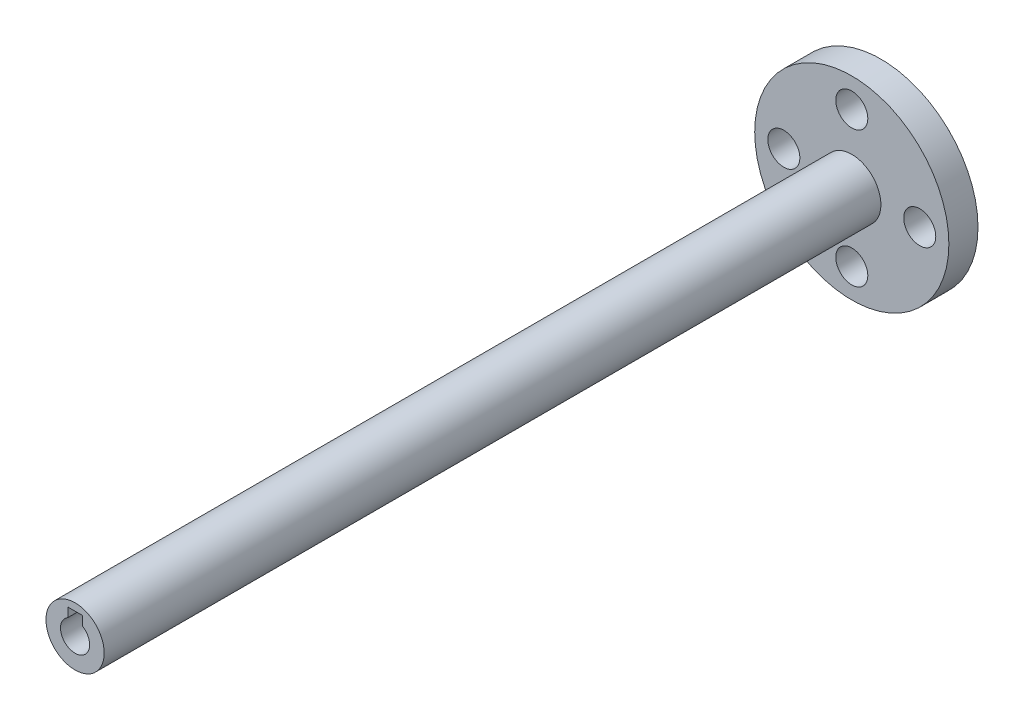
from build123d import *

# Parameters (mm, degrees)
SKETCH_1_R          = 10
SKETCH_1_R_2        = 1.65
EXTRUDE_1_DEPTH     = 3
SKETCH_2_R          = 3
EXTRUDE_2_DEPTH     = 80
CUT_EXTRUDE_1_DEPTH = 20


with BuildPart() as part:
    # 草图1 → 凸台-拉伸1 (new body)
    with BuildSketch(Plane.XY):
        Circle(SKETCH_1_R)
        with Locations((0, 7)):
            Circle(SKETCH_1_R_2, mode=Mode.SUBTRACT)
        with Locations((7, 0)):
            Circle(SKETCH_1_R_2, mode=Mode.SUBTRACT)
        with Locations((0, -7)):
            Circle(SKETCH_1_R_2, mode=Mode.SUBTRACT)
        with Locations((-7, 0)):
            Circle(SKETCH_1_R_2, mode=Mode.SUBTRACT)
    extrude(amount=EXTRUDE_1_DEPTH)

    # 草图2 → 凸台-拉伸2 (add)
    with BuildSketch(Plane.XY.offset(3)):
        Circle(SKETCH_2_R)
    extrude(amount=EXTRUDE_2_DEPTH)

    # 草图3 → 切除-拉伸1 (cut)
    with BuildSketch(Plane.XY.offset(83)):
        with BuildLine():
            Line((-0.75, 1.299038106), (-0.75, 2.25))
            Line((-0.75, 2.25), (0.75, 2.25))
            Line((0.75, 2.25), (0.75, 1.299038106))
            ThreePointArc((0.75, 1.299038106), (0, -1.5), (-0.75, 1.299038106))
        make_face()
    extrude(amount=-CUT_EXTRUDE_1_DEPTH, mode=Mode.SUBTRACT)


solid = part.part
